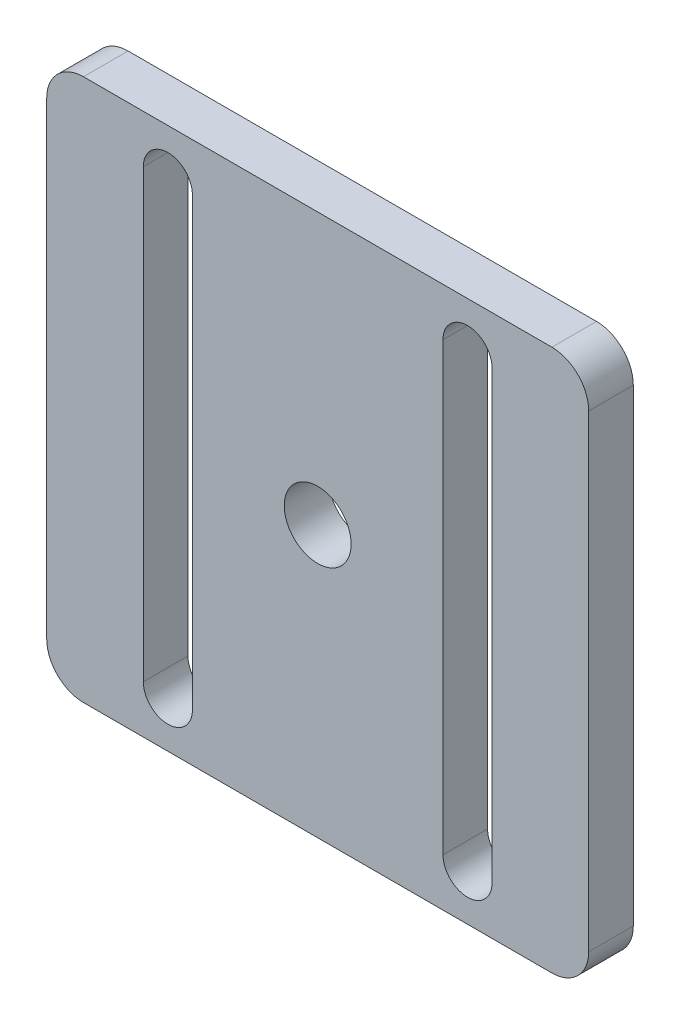
from build123d import *

# Parameters (mm, degrees)
CROQUIS1_R              = 1.5
SALIENTE_EXTRUIR1_DEPTH = 2
CORTAR_EXTRUIR1_START   = -2
CORTAR_EXTRUIR1_DEPTH   = 2


with BuildPart() as part:
    # Croquis1 → Saliente-Extruir1 (new body)
    with BuildSketch(Plane.XY):
        with BuildLine():
            Line((-117.327111855, 45.850197678), (-96.327111855, 45.850197678))
            ThreePointArc((-96.327111855, 45.850197678), (-94.912898293, 46.435984115), (-94.327111855, 47.850197678))
            Line((-94.327111855, 47.850197678), (-94.327111855, 68.850197678))
            ThreePointArc((-94.327111855, 68.850197678), (-94.912898293, 70.26441124), (-96.327111855, 70.850197678))
            Line((-96.327111855, 70.850197678), (-117.327111855, 70.850197678))
            ThreePointArc((-117.327111855, 70.850197678), (-118.741325417, 70.26441124), (-119.327111855, 68.850197678))
            Line((-119.327111855, 68.850197678), (-119.327111855, 47.850197678))
            ThreePointArc((-119.327111855, 47.850197678), (-118.741325417, 46.435984115), (-117.327111855, 45.850197678))
        make_face()
        with Locations((-106.827111855, 58.350197678)):
            Circle(CROQUIS1_R, mode=Mode.SUBTRACT)
        with BuildLine():
            Line((-114.644626276, 68.350197678), (-114.644626276, 48.350197678))
            ThreePointArc((-114.644626276, 48.350197678), (-113.544626276, 47.250197678), (-112.444626276, 48.350197678))
            Line((-112.444626276, 48.350197678), (-112.444626276, 68.350197678))
            ThreePointArc((-112.444626276, 68.350197678), (-113.544626276, 69.450197678), (-114.644626276, 68.350197678))
        make_face(mode=Mode.SUBTRACT)
        with BuildLine():
            Line((-99.009597434, 48.350197678), (-99.009597434, 68.350197678))
            ThreePointArc((-99.009597434, 68.350197678), (-100.109597434, 69.450197678), (-101.209597434, 68.350197678))
            Line((-101.209597434, 68.350197678), (-101.209597434, 48.350197678))
            ThreePointArc((-101.209597434, 48.350197678), (-100.109597434, 47.250197678), (-99.009597434, 48.350197678))
        make_face(mode=Mode.SUBTRACT)
    extrude(amount=SALIENTE_EXTRUIR1_DEPTH)

    # Croquis2 → Cortar-Extruir1 (cut)
    with BuildSketch(Plane.XY.offset(2).offset(CORTAR_EXTRUIR1_START)):
        with BuildLine():
            Line((-96.327111855, 70.850197678), (-117.327111855, 70.850197678))
            ThreePointArc((-117.327111855, 70.850197678), (-118.741325417, 70.26441124), (-119.327111855, 68.850197678))
            Line((-119.327111855, 68.850197678), (-119.327111855, 47.850197678))
            ThreePointArc((-119.327111855, 47.850197678), (-118.741325417, 46.435984115), (-117.327111855, 45.850197678))
            Line((-117.327111855, 45.850197678), (-96.327111855, 45.850197678))
            ThreePointArc((-96.327111855, 45.850197678), (-94.912898293, 46.435984115), (-94.327111855, 47.850197678))
            Line((-94.327111855, 47.850197678), (-94.327111855, 68.850197678))
            ThreePointArc((-94.327111855, 68.850197678), (-94.912898293, 70.26441124), (-96.327111855, 70.850197678))
        make_face()
        with BuildLine():
            Line((-96.327111855, 70.500197678), (-117.327111855, 70.500197678))
            ThreePointArc((-117.327111855, 70.500197678), (-118.493838044, 70.016923867), (-118.977111855, 68.850197678))
            Line((-118.977111855, 68.850197678), (-118.977111855, 47.850197678))
            ThreePointArc((-118.977111855, 47.850197678), (-118.493838044, 46.683471489), (-117.327111855, 46.200197678))
            Line((-117.327111855, 46.200197678), (-96.327111855, 46.200197678))
            ThreePointArc((-96.327111855, 46.200197678), (-95.160385666, 46.683471489), (-94.677111855, 47.850197678))
            Line((-94.677111855, 47.850197678), (-94.677111855, 68.850197678))
            ThreePointArc((-94.677111855, 68.850197678), (-95.160385666, 70.016923867), (-96.327111855, 70.500197678))
        make_face(mode=Mode.SUBTRACT)
    extrude(amount=CORTAR_EXTRUIR1_DEPTH, mode=Mode.SUBTRACT)


solid = part.part
